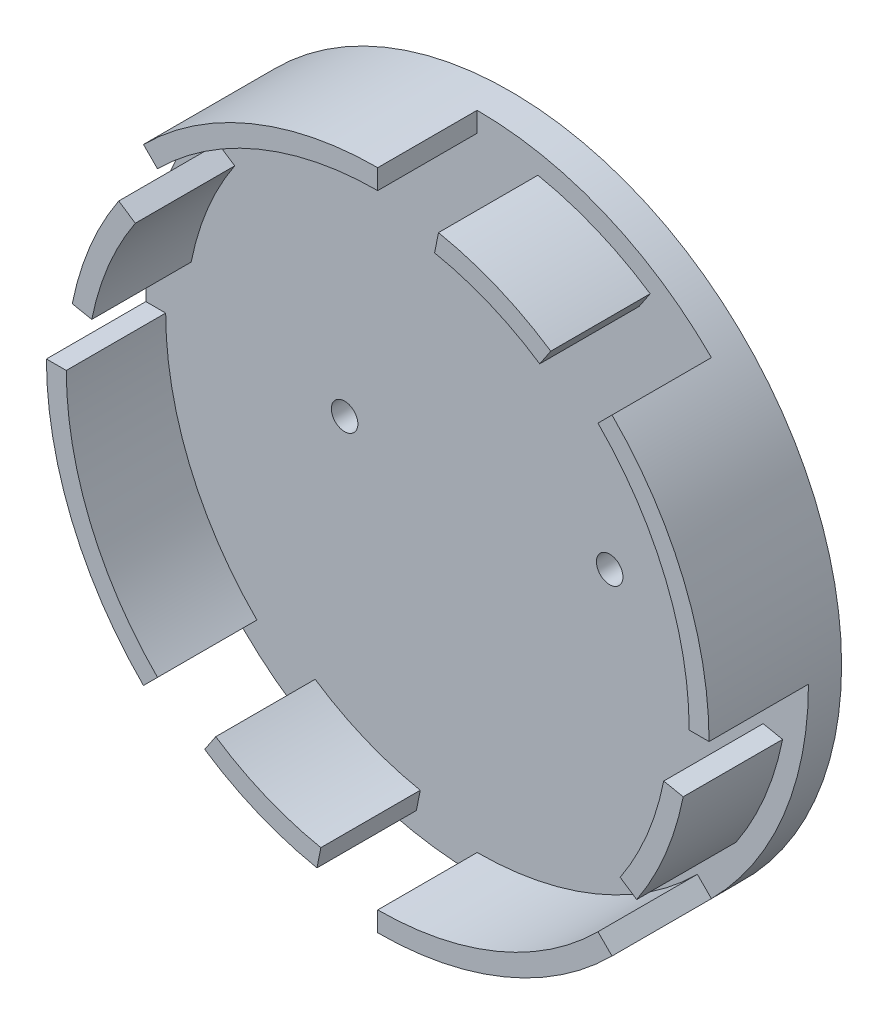
from build123d import *
from build123d.topology import SkipClean

# Parameters (mm, degrees)
SKETCH_1_R      = 50
SKETCH_1_R_2    = 2
EXTRUDE_1_DEPTH = 5
EXTRUDE_2_DEPTH = 15
EXTRUDE_3_DEPTH = 15
EXTRUDE_4_DEPTH = 15


with BuildPart() as part:
    # 草图1 → 凸台-拉伸1 (new body)
    with BuildSketch(Plane.XY):
        Circle(SKETCH_1_R)
        with Locations((-20, 0)):
            Circle(SKETCH_1_R_2, mode=Mode.SUBTRACT)
        with Locations((20, 0)):
            Circle(SKETCH_1_R_2, mode=Mode.SUBTRACT)
    extrude(amount=EXTRUDE_1_DEPTH)

    # 草图2 → 凸台-拉伸2 (add)
    with SkipClean():  # the faces are left unmerged after this step: merging them gives an invalid solid
        with BuildSketch(Plane.XY.offset(5)):
            with BuildLine():
                Line((0, 50), (0, 47))
                ThreePointArc((0, 47), (-17.986121321, 43.422338028), (-33.234018716, 33.234018716))
                Line((-33.234018716, 33.234018716), (-35.355339059, 35.355339059))
                ThreePointArc((-35.355339059, 35.355339059), (-19.134171618, 46.193976626), (0, 50))
            make_face()
        extrude(amount=EXTRUDE_2_DEPTH)

    # 草图5 → 凸台-拉伸3 (add)
    with SkipClean():  # the faces are left unmerged after this step: merging them gives an invalid solid
        with BuildSketch(Plane.XY.offset(5)):
            with BuildLine():
                Line((-35.355339059, 35.355339059), (-33.234018716, 33.234018716))
                ThreePointArc((-33.234018716, 33.234018716), (-17.986121321, 43.422338028), (0, 47))
                Line((0, 47), (0, 50))
                ThreePointArc((0, 50), (-19.134171618, 46.193976626), (-35.355339059, 35.355339059))
            make_face()
            with BuildLine():
                Line((-50, 0), (-47, 0))
                ThreePointArc((-47, 0), (-43.422338028, -17.986121321), (-33.234018716, -33.234018716))
                Line((-33.234018716, -33.234018716), (-35.355339059, -35.355339059))
                ThreePointArc((-35.355339059, -35.355339059), (-46.193976626, -19.134171618), (-50, 0))
            make_face()
            with BuildLine():
                Line((33.234018716, 33.234018716), (35.355339059, 35.355339059))
                ThreePointArc((35.355339059, 35.355339059), (46.193976626, 19.134171618), (50, 0))
                Line((50, 0), (47, 0))
                ThreePointArc((47, 0), (43.422338028, 17.986121321), (33.234018716, 33.234018716))
            make_face()
            with BuildLine():
                Line((0, -47), (0, -50))
                ThreePointArc((0, -50), (19.134171618, -46.193976626), (35.355339059, -35.355339059))
                Line((35.355339059, -35.355339059), (33.234018716, -33.234018716))
                ThreePointArc((33.234018716, -33.234018716), (17.986121321, -43.422338028), (0, -47))
            make_face()
        extrude(amount=EXTRUDE_3_DEPTH)

    # 草图6 → 凸台-拉伸4 (add)
    with SkipClean():  # the faces are left unmerged after this step: merging them gives an invalid solid
        with BuildSketch(Plane.XY.offset(5)):
            with BuildLine():
                Line((-39.079071778, 26.111800952), (-36.584662941, 24.445090253))
                ThreePointArc((-36.584662941, 24.445090253), (-40.65069943, 16.838071024), (-43.154552338, 8.583974169))
                Line((-43.154552338, 8.583974169), (-46.096908179, 9.169245135))
                ThreePointArc((-46.096908179, 9.169245135), (-43.422338028, 17.986121321), (-39.079071778, 26.111800952))
            make_face()
            with BuildLine():
                Line((9.169245135, 46.096908179), (8.583974169, 43.154552338))
                ThreePointArc((8.583974169, 43.154552338), (16.838071024, 40.65069943), (24.445090253, 36.584662941))
                Line((24.445090253, 36.584662941), (26.111800952, 39.079071778))
                ThreePointArc((26.111800952, 39.079071778), (17.986121321, 43.422338028), (9.169245135, 46.096908179))
            make_face()
            with BuildLine():
                Line((46.096908179, -9.169245135), (43.154552338, -8.583974169))
                ThreePointArc((43.154552338, -8.583974169), (40.65069943, -16.838071024), (36.584662941, -24.445090253))
                Line((36.584662941, -24.445090253), (39.079071778, -26.111800952))
                ThreePointArc((39.079071778, -26.111800952), (43.422338028, -17.986121321), (46.096908179, -9.169245135))
            make_face()
            with BuildLine():
                Line((-9.169245135, -46.096908179), (-8.583974169, -43.154552338))
                ThreePointArc((-8.583974169, -43.154552338), (-16.838071024, -40.65069943), (-24.445090253, -36.584662941))
                Line((-24.445090253, -36.584662941), (-26.111800952, -39.079071778))
                ThreePointArc((-26.111800952, -39.079071778), (-17.986121321, -43.422338028), (-9.169245135, -46.096908179))
            make_face()
        extrude(amount=EXTRUDE_4_DEPTH)


solid = part.part
